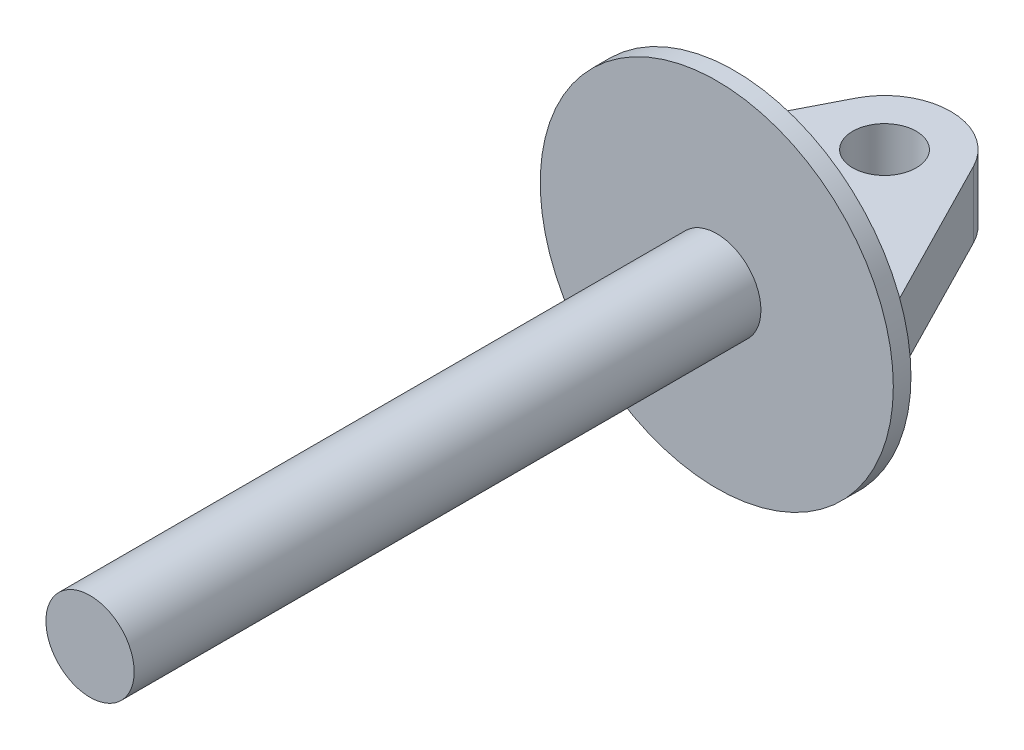
from build123d import *

# Parameters (mm, degrees)
SKETCH1_R           = 12.7
SKETCH1_R_2         = 11.1125
SKETCH1_R_3         = 3.175
BOSS_EXTRUDE1_DEPTH = 2.54
SKETCH1_3_R         = 3.175
BOSS_EXTRUDE2_DEPTH = 47.625
CHAMFER1_SIZE       = 2.54
CHAMFER1_SIZE2      = 1.27
SKETCH2_R           = 2.286
BOSS_EXTRUDE3_DEPTH = 2.38125
FILLET1_R           = 3.175
FILLET2_R           = 2.38125


with BuildPart() as part:
    # Sketch1 → Boss-Extrude1 (new body)
    # profile 1 of 3: a face of its own
    with BuildSketch(Plane.XY):
        Circle(SKETCH1_R)
        Circle(SKETCH1_R_2, mode=Mode.SUBTRACT)
    # profile 2 of 3: a face of its own
    with BuildSketch(Plane.XY):
        Circle(SKETCH1_R_2)
        Circle(SKETCH1_R_3, mode=Mode.SUBTRACT)
    # profile 3 of 3: a face of its own
    with BuildSketch(Plane.XY):
        Circle(SKETCH1_R_3)
    extrude(amount=BOSS_EXTRUDE1_DEPTH)

    # Sketch1<3> → Boss-Extrude2 (add)
    with BuildSketch(Plane.XY):
        Circle(SKETCH1_3_R)
    extrude(amount=BOSS_EXTRUDE2_DEPTH)

    # Chamfer1
    chamfer1_edges = [part.edges().sort_by_distance(p)[0] for p in [
        (-12.7, 0, 0),
    ]]
    chamfer1_side = [part.faces().sort_by_distance(p)[0] for p in [
        (0, 0, 0),
    ]]
    chamfer(chamfer1_edges, length=CHAMFER1_SIZE, length2=CHAMFER1_SIZE2, reference=chamfer1_side[0])

    # Sketch2 → Boss-Extrude3 (add, symmetric)
    with BuildSketch(Plane(origin=(0, 0, 0), x_dir=(1, 0, 0), z_dir=(0, 1, 0))):
        with BuildLine():
            Line((-4.240295204, 11.693248793), (-11.1125, -1.74625))
            Line((-11.1125, -1.74625), (11.1125, -1.74625))
            Line((11.1125, -1.74625), (4.240295204, 11.693248793))
            ThreePointArc((4.240295204, 11.693248793), (0, 14.2875), (-4.240295204, 11.693248793))
        make_face()
        with Locations(Location((0, 9.525, 0), (0, 0, 90))):
            Circle(SKETCH2_R, mode=Mode.SUBTRACT)
    extrude(amount=BOSS_EXTRUDE3_DEPTH, both=True)

    # Fillet1
    fillet1_edges = [part.edges().sort_by_distance(p)[0] for p in [
        (10.263836295, -1.194873852, 0.086576696),
        (-10.240026318, 0, 0.040013159),
        (10.263836295, 1.194873852, 0.086576696),
    ]]
    fillet(fillet1_edges, radius=FILLET1_R)

    # Fillet2
    fillet2_edges = [part.edges().sort_by_distance(p)[0] for p in [
        (0, 2.38125, 0),
        (0, -2.38125, 0),
    ]]
    fillet(fillet2_edges, radius=FILLET2_R)


solid = part.part
